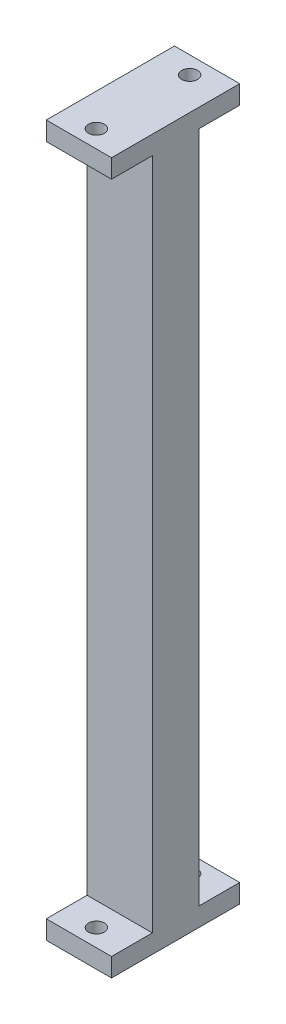
from build123d import *

# Parameters (mm, degrees)
SKETCH1_W           = 14
SKETCH1_H           = 10
BOSS_EXTRUDE1_DEPTH = 76.2
SKETCH3_W           = 14
SKETCH3_H           = 27.5
SKETCH3_R           = 1.7
BOSS_EXTRUDE3_DEPTH = 4


with BuildPart() as part:
    # Sketch1 → Boss-Extrude1 (new, symmetric)
    with BuildSketch(Plane(origin=(0, 0, 0), x_dir=(1, 0, 0), z_dir=(0, 1, 0))):
        Rectangle(SKETCH1_W, SKETCH1_H)
    extrude(amount=BOSS_EXTRUDE1_DEPTH, both=True)

    # Sketch3 → Boss-Extrude3 (add)
    with BuildSketch(Plane(origin=(0, 76.2, 0), x_dir=(1, 0, 0), z_dir=(0, 1, 0))):
        Rectangle(SKETCH3_W, SKETCH3_H)
        with Locations(Location((0, 10, 0), (0, 0, 270))):
            Circle(SKETCH3_R, mode=Mode.SUBTRACT)
        with Locations(Location((0, -10, 0), (0, 0, 270))):
            Circle(SKETCH3_R, mode=Mode.SUBTRACT)
    boss_extrude3 = extrude(amount=-BOSS_EXTRUDE3_DEPTH)

    # Mirror1: Boss-Extrude3 across plane
    add(boss_extrude3.mirror(Plane.ZX))


solid = part.part
